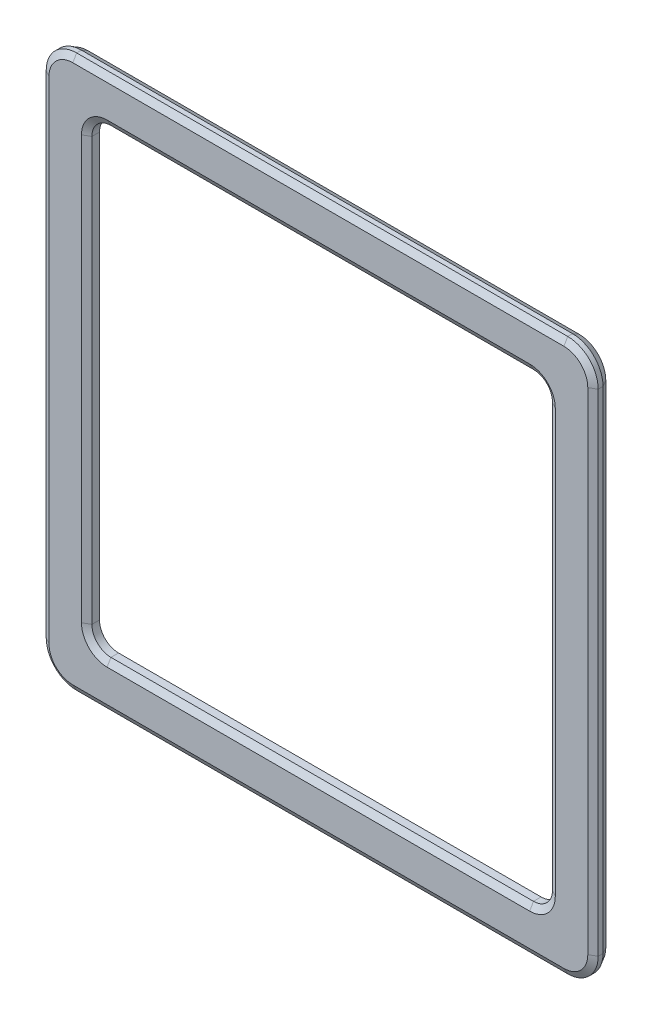
from build123d import *
from OCP.BRepFilletAPI import BRepFilletAPI_MakeChamfer

# Parameters (mm, degrees)
ESQUISSE1_W        = 145
ESQUISSE1_H        = 145
ESQUISSE1_W_2      = 121
ESQUISSE1_H_2      = 121
BOSS_EXTRU_1_DEPTH = 4
CONG_3_R           = 8
CONG_4_R           = 5
CHANFREIN1_SIZE    = 1
CHANFREIN1_SIZE2   = 1.732050808


with BuildPart() as part:
    # Esquisse1 → Boss.-Extru.1 (new body)
    with BuildSketch(Plane.XY):
        with Locations((72.5, 72.5)):
            Rectangle(ESQUISSE1_W, ESQUISSE1_H)
        with Locations((72.5, 72.5)):
            Rectangle(ESQUISSE1_W_2, ESQUISSE1_H_2, mode=Mode.SUBTRACT)
    extrude(amount=BOSS_EXTRU_1_DEPTH)

    # Congé3
    cong_3_edges = [part.edges().sort_by_distance(p)[0] for p in [
        (0, 145, 2),
        (145, 145, 2),
        (145, 0, 2),
        (0, 0, 2),
    ]]
    fillet(cong_3_edges, radius=CONG_3_R)

    # Congé4
    cong_4_edges = [part.edges().sort_by_distance(p)[0] for p in [
        (133, 133, 2),
        (12, 133, 2),
        (12, 12, 2),
        (133, 12, 2),
    ]]
    fillet(cong_4_edges, radius=CONG_4_R)

    # Chanfrein1: one chamfer whose edges measure the first distance from different faces: ONE call of the kernel's chamfer builder (chamfer() names one face for all edges)
    chanfrein1_edges_1 = [part.edges().sort_by_distance(p)[0] for p in [
        (72.5, 145, 0),
        (0, 72.5, 0),
        (145, 72.5, 0),
        (72.5, 0, 0),
        (142.656854249, 2.343145751, 0),
        (2.343145751, 2.343145751, 0),
        (2.343145751, 142.656854249, 0),
        (142.656854249, 142.656854249, 0),
    ]]
    chanfrein1_side_1 = [part.faces().sort_by_distance(p)[0] for p in [
        (72.5, 9.949390335, 0),
    ]]
    chanfrein1_edges_2 = [part.edges().sort_by_distance(p)[0] for p in [
        (72.5, 145, 4),
    ]]
    chanfrein1_side_2 = [part.faces().sort_by_distance(p)[0] for p in [
        (72.5, 145, 2),
    ]]
    chanfrein1_edges_3 = [part.edges().sort_by_distance(p)[0] for p in [
        (145, 72.5, 4),
    ]]
    chanfrein1_side_3 = [part.faces().sort_by_distance(p)[0] for p in [
        (145, 72.5, 2),
    ]]
    chanfrein1_edges_4 = [part.edges().sort_by_distance(p)[0] for p in [
        (0, 72.5, 4),
    ]]
    chanfrein1_side_4 = [part.faces().sort_by_distance(p)[0] for p in [
        (0, 72.5, 2),
    ]]
    chanfrein1_edges_5 = [part.edges().sort_by_distance(p)[0] for p in [
        (72.5, 0, 4),
    ]]
    chanfrein1_side_5 = [part.faces().sort_by_distance(p)[0] for p in [
        (72.5, 0, 2),
    ]]
    chanfrein1_edges_6 = [part.edges().sort_by_distance(p)[0] for p in [
        (142.656854249, 2.343145751, 4),
    ]]
    chanfrein1_side_6 = [part.faces().sort_by_distance(p)[0] for p in [
        (142.656854249, 2.343145751, 2),
    ]]
    chanfrein1_edges_7 = [part.edges().sort_by_distance(p)[0] for p in [
        (2.343145751, 2.343145751, 4),
    ]]
    chanfrein1_side_7 = [part.faces().sort_by_distance(p)[0] for p in [
        (2.343145751, 2.343145751, 2),
    ]]
    chanfrein1_edges_8 = [part.edges().sort_by_distance(p)[0] for p in [
        (2.343145751, 142.656854249, 4),
    ]]
    chanfrein1_side_8 = [part.faces().sort_by_distance(p)[0] for p in [
        (2.343145751, 142.656854249, 2),
    ]]
    chanfrein1_edges_9 = [part.edges().sort_by_distance(p)[0] for p in [
        (142.656854249, 142.656854249, 4),
    ]]
    chanfrein1_side_9 = [part.faces().sort_by_distance(p)[0] for p in [
        (142.656854249, 142.656854249, 2),
    ]]
    chanfrein1_edges_10 = [part.edges().sort_by_distance(p)[0] for p in [
        (72.5, 12, 0),
        (72.5, 12, 4),
    ]]
    chanfrein1_side_10 = [part.faces().sort_by_distance(p)[0] for p in [
        (72.5, 12, 2),
    ]]
    chanfrein1_edges_11 = [part.edges().sort_by_distance(p)[0] for p in [
        (133, 72.5, 0),
        (133, 72.5, 4),
    ]]
    chanfrein1_side_11 = [part.faces().sort_by_distance(p)[0] for p in [
        (133, 72.5, 2),
    ]]
    chanfrein1_edges_12 = [part.edges().sort_by_distance(p)[0] for p in [
        (72.5, 133, 0),
        (72.5, 133, 4),
    ]]
    chanfrein1_side_12 = [part.faces().sort_by_distance(p)[0] for p in [
        (72.5, 133, 2),
    ]]
    chanfrein1_edges_13 = [part.edges().sort_by_distance(p)[0] for p in [
        (12, 72.5, 0),
        (12, 72.5, 4),
    ]]
    chanfrein1_side_13 = [part.faces().sort_by_distance(p)[0] for p in [
        (12, 72.5, 2),
    ]]
    chanfrein1_edges_14 = [part.edges().sort_by_distance(p)[0] for p in [
        (131.535533906, 13.464466094, 0),
        (131.535533906, 13.464466094, 4),
    ]]
    chanfrein1_side_14 = [part.faces().sort_by_distance(p)[0] for p in [
        (131.535533906, 13.464466094, 2),
    ]]
    chanfrein1_edges_15 = [part.edges().sort_by_distance(p)[0] for p in [
        (131.535533906, 131.535533906, 0),
        (131.535533906, 131.535533906, 4),
    ]]
    chanfrein1_side_15 = [part.faces().sort_by_distance(p)[0] for p in [
        (131.535533906, 131.535533906, 2),
    ]]
    chanfrein1_edges_16 = [part.edges().sort_by_distance(p)[0] for p in [
        (13.464466094, 131.535533906, 0),
        (13.464466094, 131.535533906, 4),
    ]]
    chanfrein1_side_16 = [part.faces().sort_by_distance(p)[0] for p in [
        (13.464466094, 131.535533906, 2),
    ]]
    chanfrein1_edges_17 = [part.edges().sort_by_distance(p)[0] for p in [
        (13.464466094, 13.464466094, 0),
        (13.464466094, 13.464466094, 4),
    ]]
    chanfrein1_side_17 = [part.faces().sort_by_distance(p)[0] for p in [
        (13.464466094, 13.464466094, 2),
    ]]
    chanfrein1 = BRepFilletAPI_MakeChamfer(part.part.solid().wrapped)
    for e in chanfrein1_edges_1:
        chanfrein1.Add(CHANFREIN1_SIZE, CHANFREIN1_SIZE2, e.wrapped, chanfrein1_side_1[0].wrapped)  # the first distance lies on this face
    for e in chanfrein1_edges_2:
        chanfrein1.Add(CHANFREIN1_SIZE, CHANFREIN1_SIZE2, e.wrapped, chanfrein1_side_2[0].wrapped)  # the first distance lies on this face
    for e in chanfrein1_edges_3:
        chanfrein1.Add(CHANFREIN1_SIZE, CHANFREIN1_SIZE2, e.wrapped, chanfrein1_side_3[0].wrapped)  # the first distance lies on this face
    for e in chanfrein1_edges_4:
        chanfrein1.Add(CHANFREIN1_SIZE, CHANFREIN1_SIZE2, e.wrapped, chanfrein1_side_4[0].wrapped)  # the first distance lies on this face
    for e in chanfrein1_edges_5:
        chanfrein1.Add(CHANFREIN1_SIZE, CHANFREIN1_SIZE2, e.wrapped, chanfrein1_side_5[0].wrapped)  # the first distance lies on this face
    for e in chanfrein1_edges_6:
        chanfrein1.Add(CHANFREIN1_SIZE, CHANFREIN1_SIZE2, e.wrapped, chanfrein1_side_6[0].wrapped)  # the first distance lies on this face
    for e in chanfrein1_edges_7:
        chanfrein1.Add(CHANFREIN1_SIZE, CHANFREIN1_SIZE2, e.wrapped, chanfrein1_side_7[0].wrapped)  # the first distance lies on this face
    for e in chanfrein1_edges_8:
        chanfrein1.Add(CHANFREIN1_SIZE, CHANFREIN1_SIZE2, e.wrapped, chanfrein1_side_8[0].wrapped)  # the first distance lies on this face
    for e in chanfrein1_edges_9:
        chanfrein1.Add(CHANFREIN1_SIZE, CHANFREIN1_SIZE2, e.wrapped, chanfrein1_side_9[0].wrapped)  # the first distance lies on this face
    for e in chanfrein1_edges_10:
        chanfrein1.Add(CHANFREIN1_SIZE, CHANFREIN1_SIZE2, e.wrapped, chanfrein1_side_10[0].wrapped)  # the first distance lies on this face
    for e in chanfrein1_edges_11:
        chanfrein1.Add(CHANFREIN1_SIZE, CHANFREIN1_SIZE2, e.wrapped, chanfrein1_side_11[0].wrapped)  # the first distance lies on this face
    for e in chanfrein1_edges_12:
        chanfrein1.Add(CHANFREIN1_SIZE, CHANFREIN1_SIZE2, e.wrapped, chanfrein1_side_12[0].wrapped)  # the first distance lies on this face
    for e in chanfrein1_edges_13:
        chanfrein1.Add(CHANFREIN1_SIZE, CHANFREIN1_SIZE2, e.wrapped, chanfrein1_side_13[0].wrapped)  # the first distance lies on this face
    for e in chanfrein1_edges_14:
        chanfrein1.Add(CHANFREIN1_SIZE, CHANFREIN1_SIZE2, e.wrapped, chanfrein1_side_14[0].wrapped)  # the first distance lies on this face
    for e in chanfrein1_edges_15:
        chanfrein1.Add(CHANFREIN1_SIZE, CHANFREIN1_SIZE2, e.wrapped, chanfrein1_side_15[0].wrapped)  # the first distance lies on this face
    for e in chanfrein1_edges_16:
        chanfrein1.Add(CHANFREIN1_SIZE, CHANFREIN1_SIZE2, e.wrapped, chanfrein1_side_16[0].wrapped)  # the first distance lies on this face
    for e in chanfrein1_edges_17:
        chanfrein1.Add(CHANFREIN1_SIZE, CHANFREIN1_SIZE2, e.wrapped, chanfrein1_side_17[0].wrapped)  # the first distance lies on this face
    add(Compound.cast(chanfrein1.Shape()), mode=Mode.REPLACE)


solid = part.part
